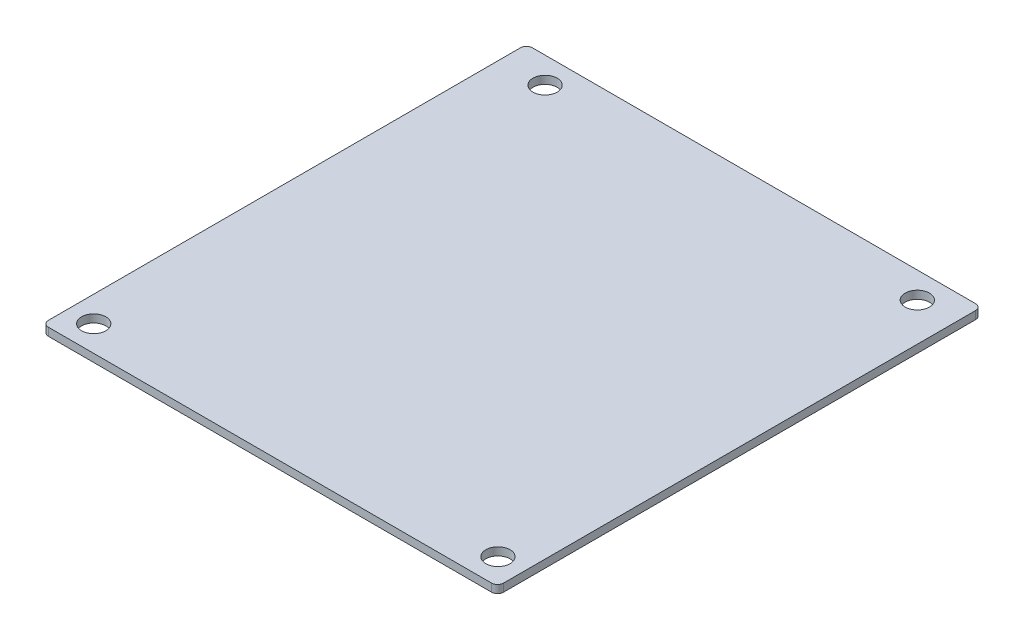
from build123d import *

# Parameters (mm, degrees)
SKETCH1_W           = 90.17
SKETCH1_H           = 95.89
BOSS_EXTRUDE1_DEPTH = 1.57
SKETCH3_R           = 2.4
CUT_EXTRUDE2_DEPTH  = 1.57
FILLET10_R          = 1.2
FILLET11_R          = 1.2
FILLET14_R          = 1.2
FILLET21_R          = 1.2


with BuildPart() as part:
    # Sketch1 → Boss-Extrude1 (new body)
    with BuildSketch(Plane(origin=(0, 0, 0), x_dir=(1, 0, 0), z_dir=(0, 1, 0))):
        Rectangle(SKETCH1_W, SKETCH1_H)
    extrude(amount=BOSS_EXTRUDE1_DEPTH)

    # Sketch3 → Cut-Extrude2 (cut)
    with BuildSketch(Plane(origin=(0, 1.57, 0), x_dir=(1, 0, 0), z_dir=(0, 1, 0))):
        with Locations(Location((-40.005, -42.865, 0), (0, 0, 270))):
            Circle(SKETCH3_R)
        with Locations(Location((40.005, -42.785, 0), (0, 0, 270))):
            Circle(SKETCH3_R)
        with Locations(Location((-36.235, 42.785, 0), (0, 0, 270))):
            Circle(SKETCH3_R)
        with Locations(Location((37.515, 42.785, 0), (0, 0, 270))):
            Circle(SKETCH3_R)
    extrude(amount=-CUT_EXTRUDE2_DEPTH, mode=Mode.SUBTRACT)

    # Fillet10
    fillet10_edges = [part.edges().sort_by_distance(p)[0] for p in [
        (45.085, 0.785, 47.945),
    ]]
    fillet(fillet10_edges, radius=FILLET10_R)

    # Fillet11
    fillet11_edges = [part.edges().sort_by_distance(p)[0] for p in [
        (45.085, 0.785, -47.945),
    ]]
    fillet(fillet11_edges, radius=FILLET11_R)

    # Fillet14
    fillet14_edges = [part.edges().sort_by_distance(p)[0] for p in [
        (-45.085, 0.785, -47.945),
    ]]
    fillet(fillet14_edges, radius=FILLET14_R)

    # Fillet21
    fillet21_edges = [part.edges().sort_by_distance(p)[0] for p in [
        (-45.085, 0.785, 47.945),
    ]]
    fillet(fillet21_edges, radius=FILLET21_R)


solid = part.part
